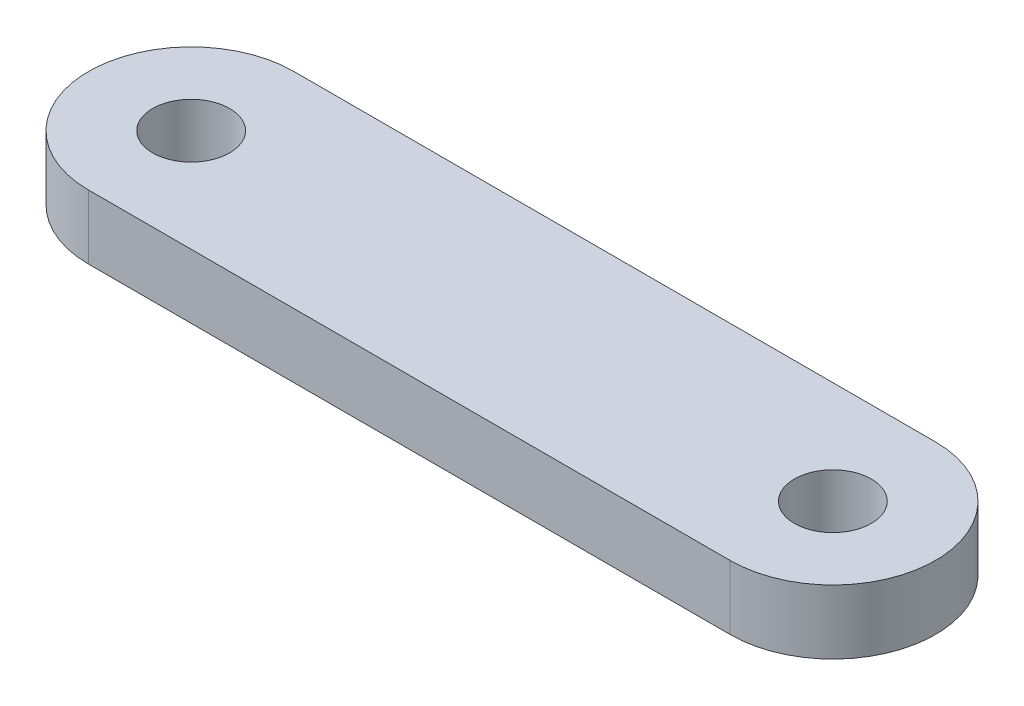
from build123d import *

# Parameters (mm, degrees)
SKETCH_1_R      = 3
EXTRUDE_1_DEPTH = 5


with BuildPart() as part:
    # 草圖1 → 填料-伸長1 (new body)
    with BuildSketch(Plane(origin=(0, 0, 0), x_dir=(1, 0, 0), z_dir=(0, 1, 0))):
        with BuildLine():
            Line((-25, 8), (25, 8))
            ThreePointArc((25, 8), (33, 0), (25, -8))
            Line((25, -8), (-25, -8))
            ThreePointArc((-25, -8), (-33, 0), (-25, 8))
        make_face()
        with Locations(Location((-25, 0, 0), (0, 0, 270))):
            Circle(SKETCH_1_R, mode=Mode.SUBTRACT)
        with Locations(Location((25, 0, 0), (0, 0, 270))):
            Circle(SKETCH_1_R, mode=Mode.SUBTRACT)
    extrude(amount=EXTRUDE_1_DEPTH)


solid = part.part
